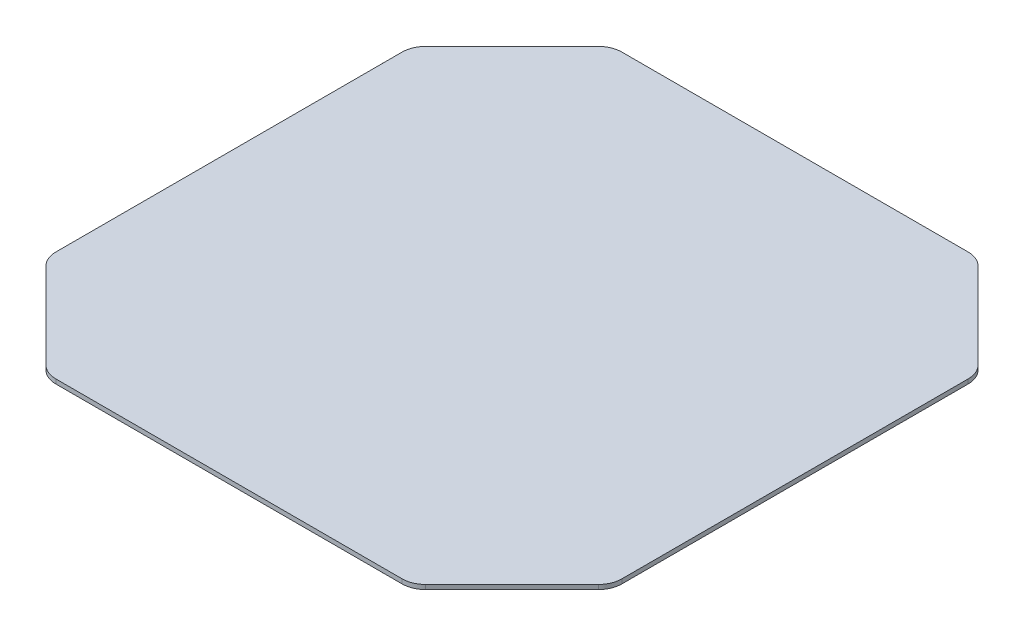
from build123d import *

# Parameters (mm, degrees)
SKETCH1_W            = 1219.2
SKETCH1_H            = 1219.2
BOSS_EXTRUDE1_DEPTH  = 9.525
CUT_EXTRUDE1_REACH   = 864.157
SKETCH2_R            = 152.4
CUT_EXTRUDE2_DEPTH   = 863.157204705
MIRROR2_COPY_1_DEPTH = 863.157204705
FILLET1_R            = 50.8


with BuildPart() as part:
    # Sketch1 → Boss-Extrude1 (new body)
    with BuildSketch(Plane(origin=(0, 0, 0), x_dir=(1, 0, 0), z_dir=(0, 1, 0))):
        Rectangle(SKETCH1_W, SKETCH1_H)
    extrude(amount=BOSS_EXTRUDE1_DEPTH)

    # Sketch2 → Cut-Extrude1 (cut, up to next)
    with BuildSketch(Plane(origin=(0, 9.525, 0), x_dir=(1, 0, 0), z_dir=(0, 1, 0)), mode=Mode.PRIVATE) as cut_extrude1_sk1:
        with Locations((-609.6, 609.6)):
            Circle(SKETCH2_R)
    cut_extrude1_tool1 = extrude(cut_extrude1_sk1.sketch, amount=-CUT_EXTRUDE1_REACH, mode=Mode.PRIVATE) & part.part
    # Sketch2 → Cut-Extrude1 (cut, up to next)
    with BuildSketch(Plane(origin=(0, 9.525, 0), x_dir=(1, 0, 0), z_dir=(0, 1, 0)), mode=Mode.PRIVATE) as cut_extrude1_sk2:
        with Locations((-609.6, -609.6)):
            Circle(SKETCH2_R)
    cut_extrude1_tool2 = extrude(cut_extrude1_sk2.sketch, amount=-CUT_EXTRUDE1_REACH, mode=Mode.PRIVATE) & part.part
    # Sketch2 → Cut-Extrude1 (cut, up to next)
    with BuildSketch(Plane(origin=(0, 9.525, 0), x_dir=(1, 0, 0), z_dir=(0, 1, 0)), mode=Mode.PRIVATE) as cut_extrude1_sk3:
        with Locations((609.6, -609.6)):
            Circle(SKETCH2_R)
    cut_extrude1_tool3 = extrude(cut_extrude1_sk3.sketch, amount=-CUT_EXTRUDE1_REACH, mode=Mode.PRIVATE) & part.part
    # Sketch2 → Cut-Extrude1 (cut, up to next)
    with BuildSketch(Plane(origin=(0, 9.525, 0), x_dir=(1, 0, 0), z_dir=(0, 1, 0)), mode=Mode.PRIVATE) as cut_extrude1_sk4:
        with Locations((609.6, 609.6)):
            Circle(SKETCH2_R)
    cut_extrude1_tool4 = extrude(cut_extrude1_sk4.sketch, amount=-CUT_EXTRUDE1_REACH, mode=Mode.PRIVATE) & part.part
    add(cut_extrude1_tool1.solids().sort_by_distance((-609.6, 9.525, -609.6))[0], mode=Mode.SUBTRACT)
    add(cut_extrude1_tool2.solids().sort_by_distance((-609.6, 9.525, 609.6))[0], mode=Mode.SUBTRACT)
    add(cut_extrude1_tool3.solids().sort_by_distance((609.6, 9.525, 609.6))[0], mode=Mode.SUBTRACT)
    add(cut_extrude1_tool4.solids().sort_by_distance((609.6, 9.525, -609.6))[0], mode=Mode.SUBTRACT)

    # Sketch3 → Cut-Extrude2 (cut, symmetric)
    with BuildSketch(Plane(origin=(0, 9.525, 0), x_dir=(1, 0, 0), z_dir=(0, 1, 0))):
        Polygon((-1846.295154261, 2849.969007356), (394.073853094, 609.6), (609.6, 394.073853094), (2849.969007356, -1846.295154261), (7330.707022067, 2634.44286045), (2634.44286045, 7330.707022067), align=None)
    cut_extrude2 = extrude(amount=CUT_EXTRUDE2_DEPTH, both=True, mode=Mode.SUBTRACT)

    # Mirror1: Cut-Extrude2 across plane
    add(cut_extrude2.mirror(Plane.XY), mode=Mode.SUBTRACT)

    # Mirror2: Cut-Extrude2 across plane
    add(cut_extrude2.mirror(Plane(origin=(0, 0, 0), x_dir=(0, 0, 1), z_dir=(1, 0, 0))), mode=Mode.SUBTRACT)

    # Mirror2 copy 1 sketch → Mirror2 copy 1 (cut, symmetric)
    with BuildSketch(Plane(origin=(0, 9.525, 0), x_dir=(-1, 0, 0), z_dir=(0, 1, 0))):
        Polygon((-1846.295154261, 2849.969007356), (394.073853094, 609.6), (609.6, 394.073853094), (2849.969007356, -1846.295154261), (7330.707022067, 2634.44286045), (2634.44286045, 7330.707022067), align=None)
    extrude(amount=MIRROR2_COPY_1_DEPTH, both=True, mode=Mode.SUBTRACT)

    # Fillet1
    fillet1_edges = [part.edges().sort_by_distance(p)[0] for p in [
        (-609.6, 4.7625, -394.073853094),
        (-394.073853094, 4.7625, -609.6),
        (-609.6, 4.7625, 394.073853094),
        (-394.073853094, 4.7625, 609.6),
        (609.6, 4.7625, -394.073853094),
        (394.073853094, 4.7625, -609.6),
        (609.6, 4.7625, 394.073853094),
        (394.073853094, 4.7625, 609.6),
    ]]
    fillet(fillet1_edges, radius=FILLET1_R)


solid = part.part
